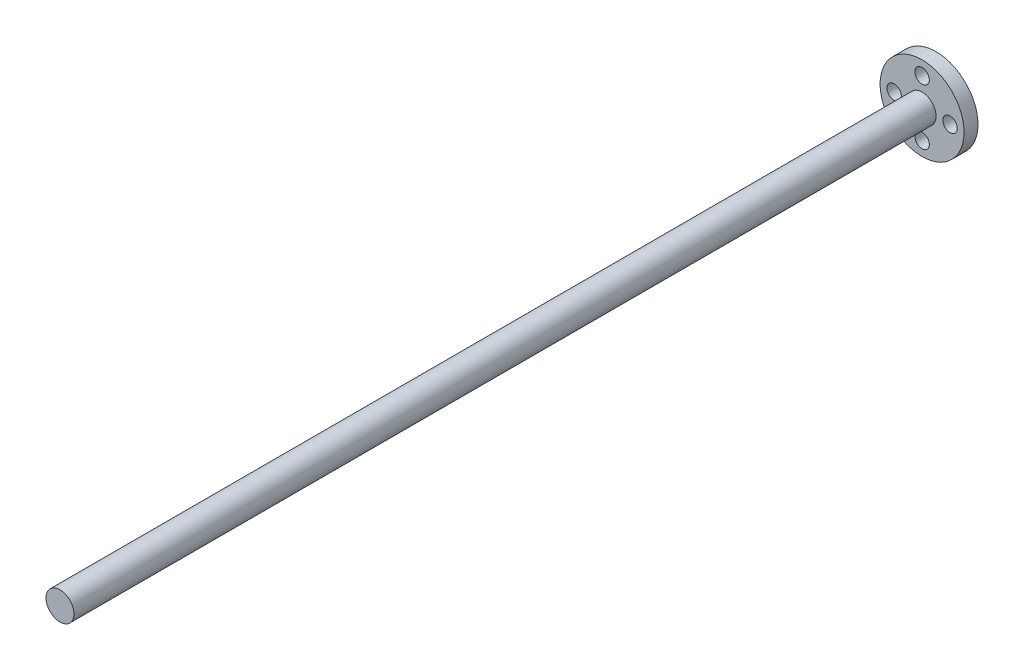
from build123d import *

# Parameters (mm, degrees)
SKETCH1_R           = 9
SKETCH1_R_2         = 1.55
BOSS_EXTRUDE1_DEPTH = 3
SKETCH2_R           = 3
BOSS_EXTRUDE2_DEPTH = 185


with BuildPart() as part:
    # Sketch1 → Boss-Extrude1 (new body)
    with BuildSketch(Plane.XY):
        Circle(SKETCH1_R)
        with Locations((-6, 0)):
            Circle(SKETCH1_R_2, mode=Mode.SUBTRACT)
        with Locations((0, 6)):
            Circle(SKETCH1_R_2, mode=Mode.SUBTRACT)
        with Locations((6, 0)):
            Circle(SKETCH1_R_2, mode=Mode.SUBTRACT)
        with Locations((0, -6)):
            Circle(SKETCH1_R_2, mode=Mode.SUBTRACT)
    extrude(amount=BOSS_EXTRUDE1_DEPTH)

    # Sketch2 → Boss-Extrude2 (add)
    with BuildSketch(Plane.XY.offset(3)):
        Circle(SKETCH2_R)
    extrude(amount=BOSS_EXTRUDE2_DEPTH)


solid = part.part
